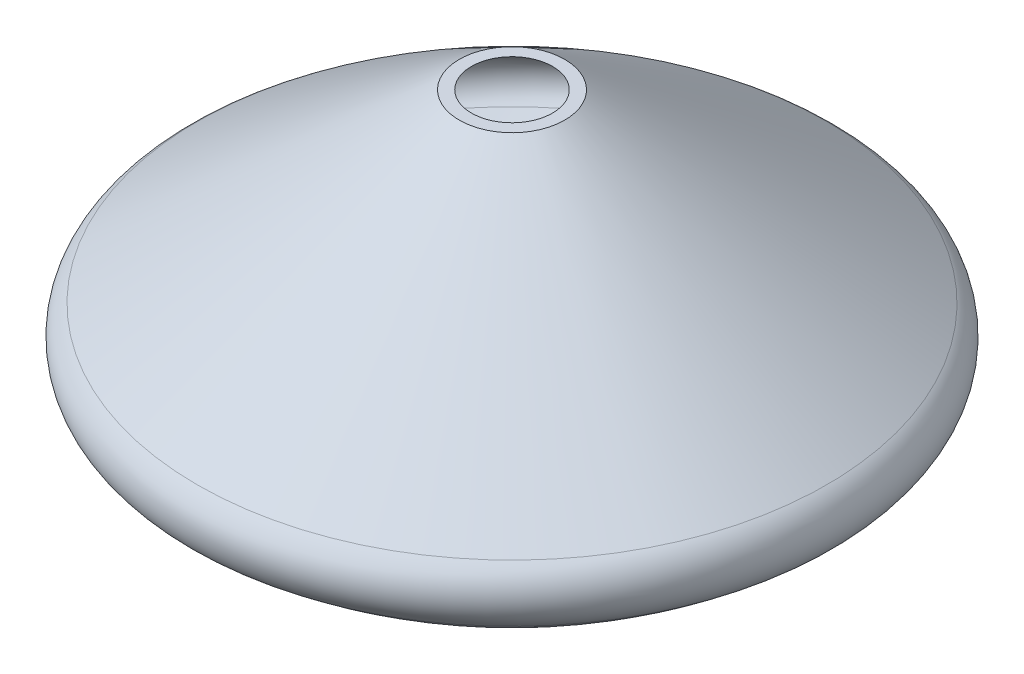
from build123d import *

# Parameters (mm, degrees)
SHELL1_T = -2


with BuildPart() as part:
    # Sketch1 → Revolve1 (revolve)
    with BuildSketch(Plane.YZ, mode=Mode.PRIVATE) as revolve1_sk:
        with BuildLine():
            Line((0, 15), (-52.620746084, 89.594662726))
            ThreePointArc((-52.620746084, 89.594662726), (-60.465449326, 93.825), (-68.569703448, 90.116066522))
            ThreePointArc((-68.569703448, 90.116066522), (-92.330076096, 47.793105207), (-100.792195067, 0))
            Line((-100.792195067, 0), (0, 0))
            Line((0, 0), (0, 15))
        make_face()
    revolve(revolve1_sk.sketch.rotate(Axis((0, -178.694901769, 0), (0, 1, 0)), 180), axis=Axis((0, -178.694901769, 0), (0, 1, 0)))

    # Shell1
    shell1_openings = [part.faces().sort_by_distance(p)[0] for p in [
        (0, 0, 0),
    ]]
    offset(amount=SHELL1_T, openings=shell1_openings, kind=Kind.INTERSECTION)


solid = part.part
